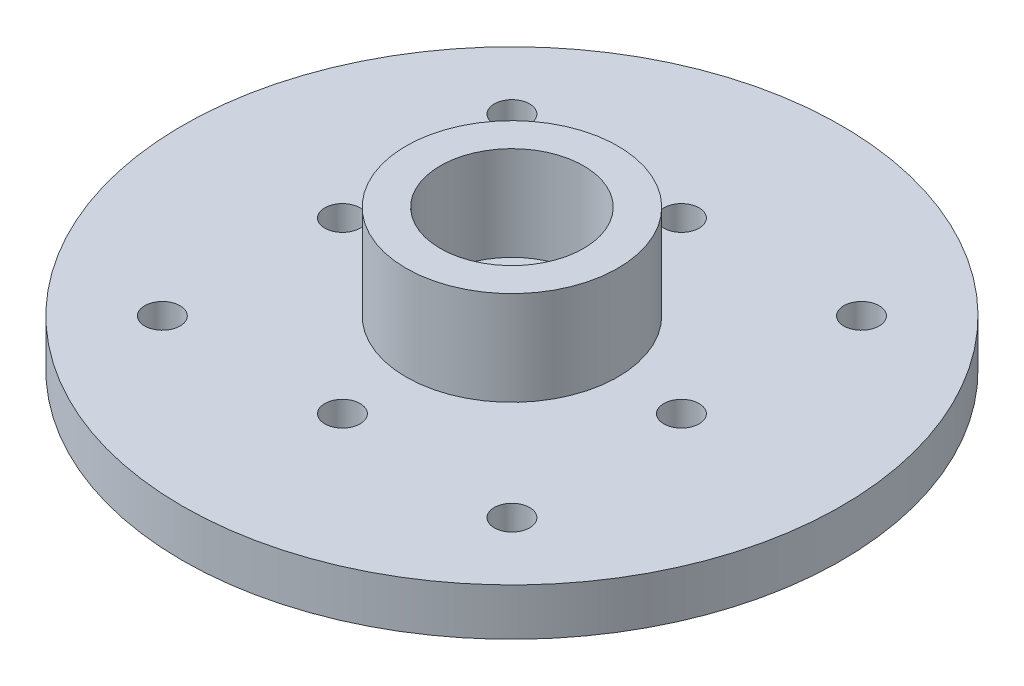
from build123d import *

# Parameters (mm, degrees)
ESQUISSE1_R             = 14
ESQUISSE1_R_2           = 0.75
BOSS_EXTRU_1_DEPTH      = 2
ESQUISSE2_R             = 4.5
BOSS_EXTRU_2_DEPTH      = 4
ESQUISSE3_R             = 3.043591675
ENL_V_MAT_EXTRU_1_DEPTH = 4
ESQUISSE4_R             = 1.75
ENL_V_MAT_EXTRU_2_DEPTH = 4
ESQUISSE5_R             = 3.5
ENL_V_MAT_EXTRU_3_DEPTH = 1.4


with BuildPart() as part:
    # Esquisse1 → Boss.-Extru.1 (new body)
    with BuildSketch(Plane(origin=(0, 0, 0), x_dir=(1, 0, 0), z_dir=(0, 1, 0))):
        with Locations(Location((0, 0, 0), (0, 0, 270))):
            Circle(ESQUISSE1_R)
        with Locations(Location((0, 7.2, 0), (0, 0, 270))):
            Circle(ESQUISSE1_R_2, mode=Mode.SUBTRACT)
        with Locations(Location((7.424621202, 7.424621202, 0), (0, 0, 270))):
            Circle(ESQUISSE1_R_2, mode=Mode.SUBTRACT)
        with Locations(Location((7.424621202, -7.424621202, 0), (0, 0, 270))):
            Circle(ESQUISSE1_R_2, mode=Mode.SUBTRACT)
        with Locations(Location((7.2, 0, 0), (0, 0, 270))):
            Circle(ESQUISSE1_R_2, mode=Mode.SUBTRACT)
        with Locations(Location((-7.424621202, -7.424621202, 0), (0, 0, 270))):
            Circle(ESQUISSE1_R_2, mode=Mode.SUBTRACT)
        with Locations(Location((0, -7.2, 0), (0, 0, 270))):
            Circle(ESQUISSE1_R_2, mode=Mode.SUBTRACT)
        with Locations(Location((-7.424621202, 7.424621202, 0), (0, 0, 270))):
            Circle(ESQUISSE1_R_2, mode=Mode.SUBTRACT)
        with Locations(Location((-7.2, 0, 0), (0, 0, 270))):
            Circle(ESQUISSE1_R_2, mode=Mode.SUBTRACT)
    extrude(amount=BOSS_EXTRU_1_DEPTH)

    # Esquisse2 → Boss.-Extru.2 (add)
    with BuildSketch(Plane(origin=(0, 2, 0), x_dir=(1, 0, 0), z_dir=(0, 1, 0))):
        with Locations(Location((0, 0, 0), (0, 0, 270))):
            Circle(ESQUISSE2_R)
    extrude(amount=BOSS_EXTRU_2_DEPTH)

    # Esquisse3 → Enlèv. mat.-Extru.1 (cut)
    with BuildSketch(Plane(origin=(0, 6, 0), x_dir=(1, 0, 0), z_dir=(0, 1, 0))):
        with Locations(Location((0, 0, 0), (0, 0, 270))):
            Circle(ESQUISSE3_R)
    extrude(amount=-ENL_V_MAT_EXTRU_1_DEPTH, mode=Mode.SUBTRACT)

    # Esquisse4 → Enlèv. mat.-Extru.2 (cut)
    with BuildSketch(Plane(origin=(0, 2, 0), x_dir=(1, 0, 0), z_dir=(0, 1, 0))):
        with Locations(Location((0, 0, 0), (0, 0, 270))):
            Circle(ESQUISSE4_R)
    extrude(amount=-ENL_V_MAT_EXTRU_2_DEPTH, mode=Mode.SUBTRACT)

    # Esquisse5 → Enlèv. mat.-Extru.3 (cut)
    with BuildSketch(Plane(origin=(0, 0, 0), x_dir=(-1, 0, 0), z_dir=(0, -1, 0))):
        with Locations(Location((0, 0, 0), (0, 0, 90))):
            Circle(ESQUISSE5_R)
    extrude(amount=-ENL_V_MAT_EXTRU_3_DEPTH, mode=Mode.SUBTRACT)


solid = part.part
